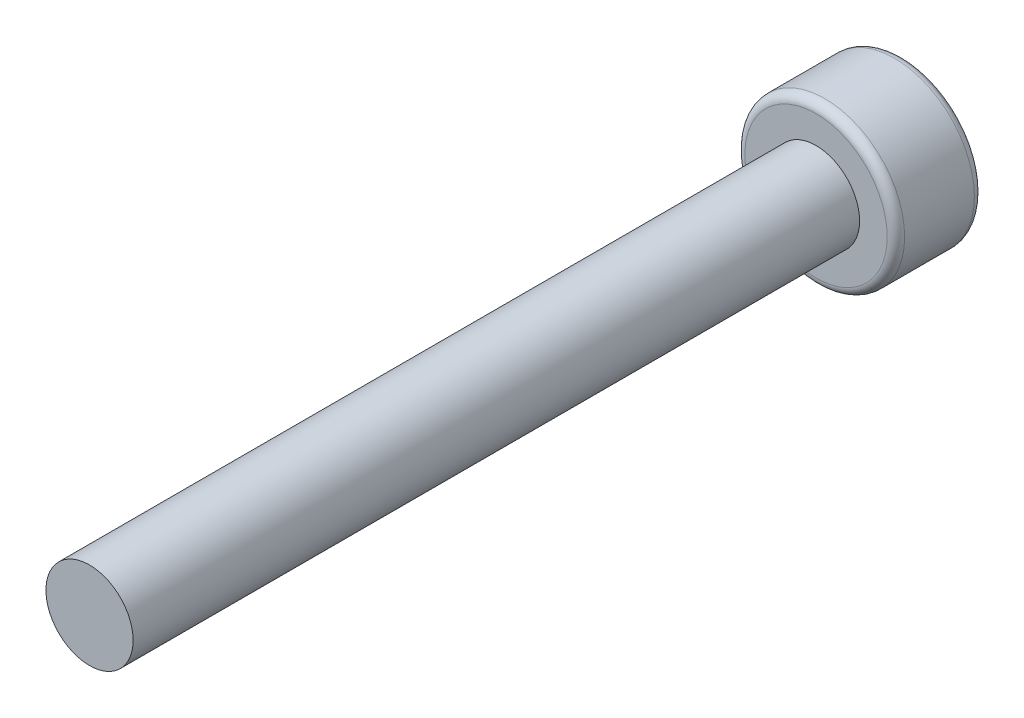
from build123d import *

# Parameters (mm, degrees)
SKETCH_1_R          = 2.75
EXTRUDE_1_DEPTH     = 3
SKETCH_2_R          = 1.5
EXTRUDE_2_DEPTH     = 25
FILLET_1_R          = 0.3
CUT_EXTRUDE_1_DEPTH = 2


with BuildPart() as part:
    # 草图1 → 凸台-拉伸1 (new body)
    with BuildSketch(Plane.XY):
        Circle(SKETCH_1_R)
    extrude(amount=EXTRUDE_1_DEPTH)

    # 草图2 → 凸台-拉伸2 (add)
    with BuildSketch(Plane.XY.offset(3)):
        Circle(SKETCH_2_R)
    extrude(amount=EXTRUDE_2_DEPTH)

    # 圆角1
    fillet_1_edges = [part.edges().sort_by_distance(p)[0] for p in [
        (-2.75, 0, 0),
        (-2.75, 0, 3),
    ]]
    fillet(fillet_1_edges, radius=FILLET_1_R)

    # 草图3 → 切除-拉伸1 (cut)
    with BuildSketch(Plane(origin=(0, 0, 0), x_dir=(-1, 0, 0), z_dir=(0, 0, -1))):
        Polygon((-0.820853493, 1.862408161), (-2.023319526, 0.220324103), (-1.202466033, -1.642084058), (0.820853493, -1.862408161), (2.023319526, -0.220324103), (1.202466033, 1.642084058), align=None)
    extrude(amount=-CUT_EXTRUDE_1_DEPTH, mode=Mode.SUBTRACT)


solid = part.part
